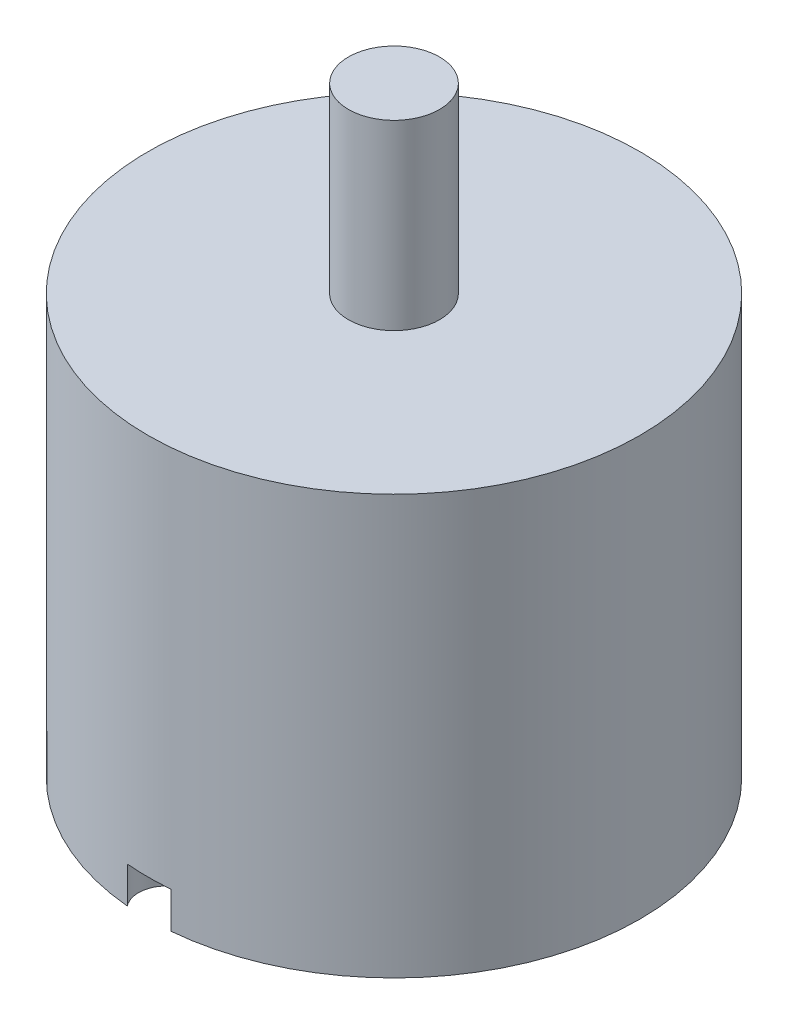
from build123d import *

# Parameters (mm, degrees)
SKETCH1_R           = 13.499973
BOSS_EXTRUDE1_DEPTH = 23.0000048
SKETCH2_R           = 2.5
BOSS_EXTRUDE2_DEPTH = 10
SKETCH3_R           = 1.499997
BOSS_EXTRUDE3_DEPTH = 2
SKETCH4_R           = 1.524
SKETCH4_R_2         = 1.5
CUT_EXTRUDE1_DEPTH  = 2


with BuildPart() as part:
    # Sketch1 → Boss-Extrude1 (new body)
    with BuildSketch(Plane(origin=(0, 0, 0), x_dir=(1, 0, 0), z_dir=(0, 1, 0))):
        with Locations(Location((0, 0, 0), (0, 0, 270))):
            Circle(SKETCH1_R)
    extrude(amount=BOSS_EXTRUDE1_DEPTH)

    # Sketch2 → Boss-Extrude2 (add)
    with BuildSketch(Plane(origin=(0, 23.0000048, 0), x_dir=(1, 0, 0), z_dir=(0, 1, 0))):
        with Locations(Location((0, 0, 0), (0, 0, 270))):
            Circle(SKETCH2_R)
    extrude(amount=BOSS_EXTRUDE2_DEPTH)

    # Sketch3 → Boss-Extrude3 (add)
    with BuildSketch(Plane.XZ):
        with Locations(Location((0, 0, 0), (0, 0, 90))):
            Circle(SKETCH3_R)
    extrude(amount=BOSS_EXTRUDE3_DEPTH)

    # Sketch4 → Cut-Extrude1 (cut)
    with BuildSketch(Plane.XZ):
        with Locations((0, 12.5000004)):
            Circle(SKETCH4_R)
        with Locations(Location((9.4999937, 0, 0), (0, 0, 270))):
            Circle(SKETCH4_R_2)
        with Locations(Location((-9.4999937, 0, 0), (0, 0, 90))):
            Circle(SKETCH4_R_2)
        with Locations((0, -12.5000004)):
            Circle(SKETCH4_R)
    extrude(amount=-CUT_EXTRUDE1_DEPTH, mode=Mode.SUBTRACT)


solid = part.part
